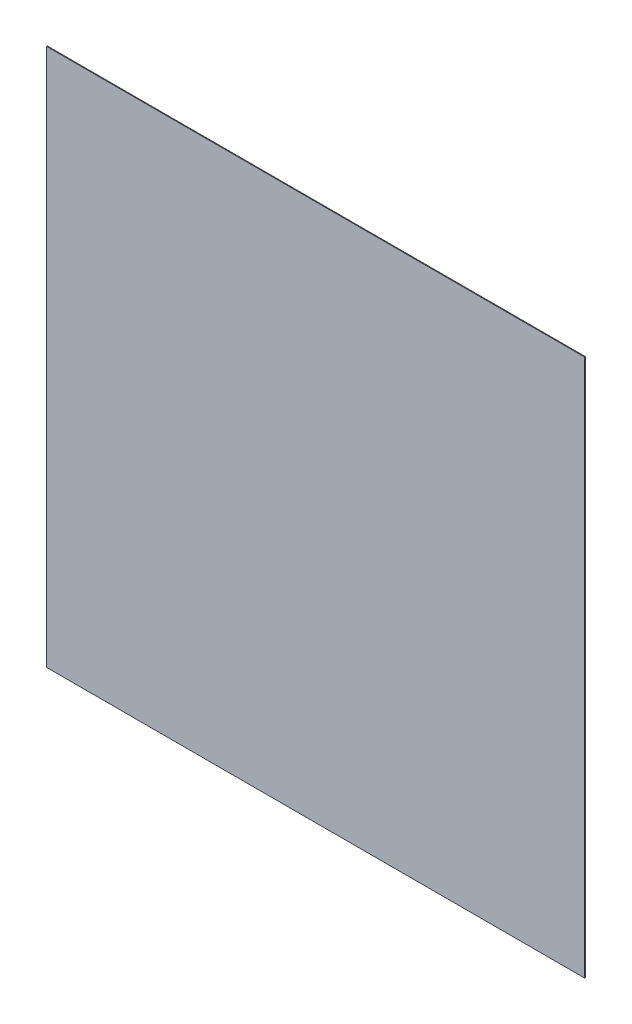
from build123d import *

# Parameters (mm, degrees)
SKETCH_2_W      = 700
SKETCH_2_H      = 700
EXTRUDE_1_DEPTH = 1


with BuildPart() as part:
    # ｽｹｯﾁ2 → ﾎﾞｽ - 押し出し1 (new body)
    with BuildSketch(Plane.XY):
        with Locations((350, 350)):
            Rectangle(SKETCH_2_W, SKETCH_2_H)
    extrude(amount=EXTRUDE_1_DEPTH)


solid = part.part
